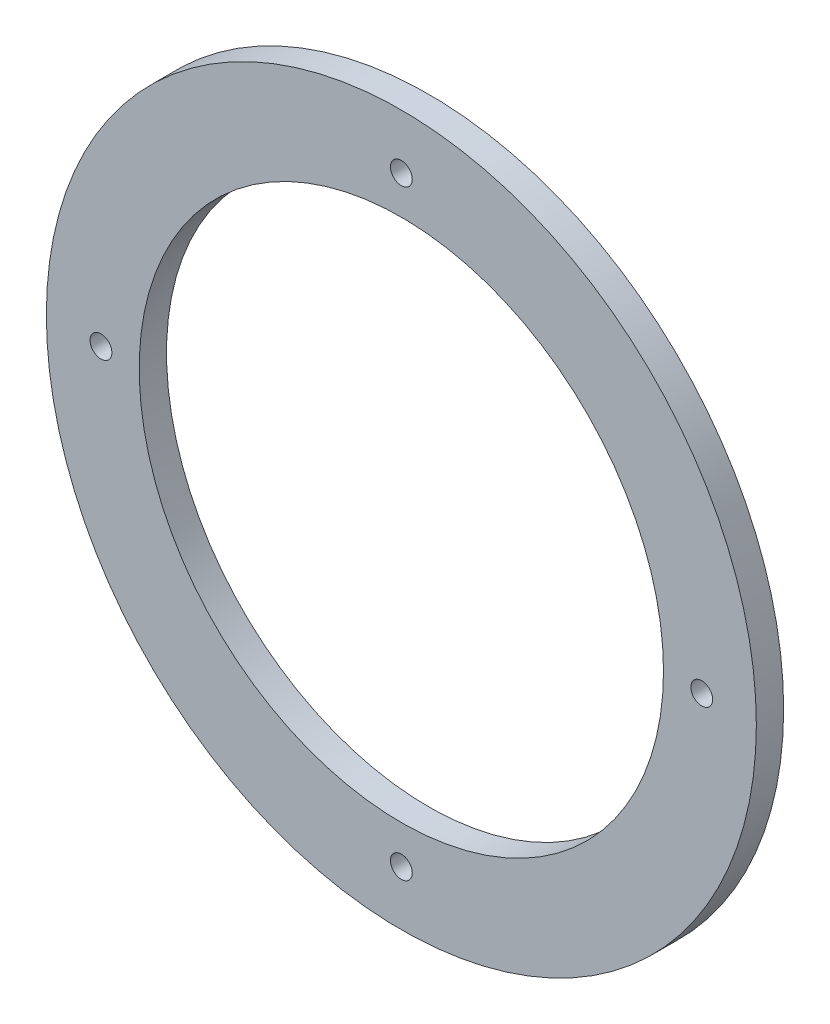
from build123d import *

# Parameters (mm, degrees)
SKETCH_1_R      = 65
SKETCH_1_R_2    = 48
SKETCH_1_R_3    = 2
EXTRUDE_1_DEPTH = 5


with BuildPart() as part:
    # 草图1 → 凸台-拉伸1 (new body)
    with BuildSketch(Plane.XY):
        Circle(SKETCH_1_R)
        Circle(SKETCH_1_R_2, mode=Mode.SUBTRACT)
        with Locations((55, 0)):
            Circle(SKETCH_1_R_3, mode=Mode.SUBTRACT)
        with Locations((0, -55)):
            Circle(SKETCH_1_R_3, mode=Mode.SUBTRACT)
        with Locations((-55, 0)):
            Circle(SKETCH_1_R_3, mode=Mode.SUBTRACT)
        with Locations((0, 55)):
            Circle(SKETCH_1_R_3, mode=Mode.SUBTRACT)
    extrude(amount=EXTRUDE_1_DEPTH)


solid = part.part
